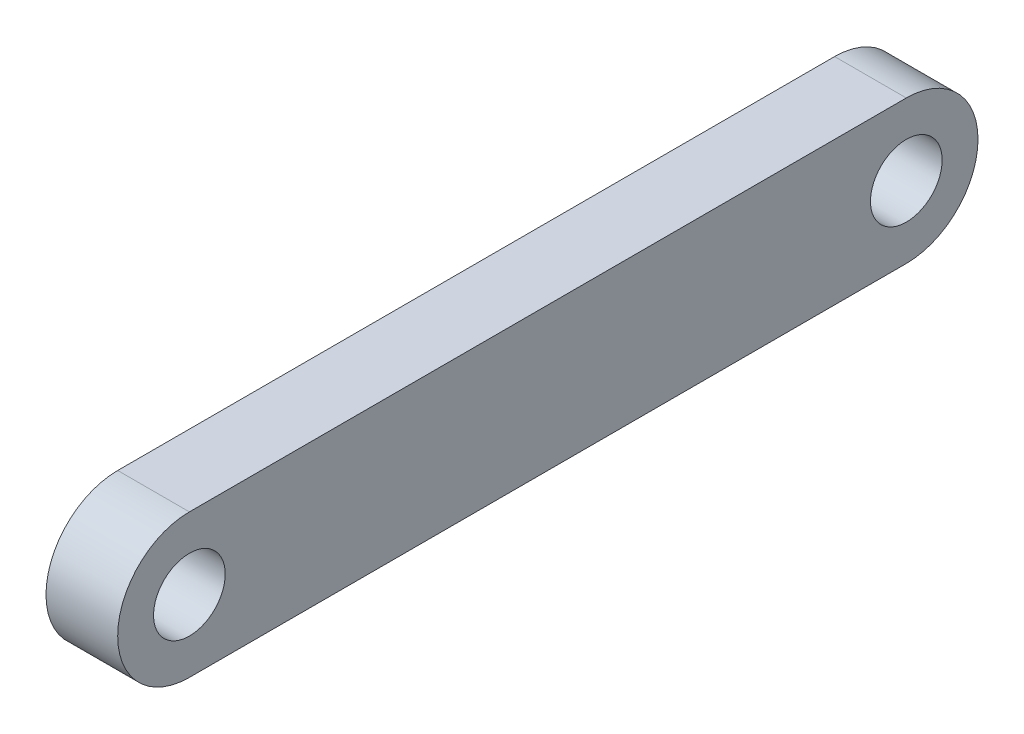
from build123d import *

# Parameters (mm, degrees)
SKETCH1_R           = 50
BOSS_EXTRUDE1_DEPTH = 100


with BuildPart() as part:
    # Sketch1 → Boss-Extrude1 (new body)
    with BuildSketch(Plane(origin=(0, 0, 0), x_dir=(0, 0, -1), z_dir=(1, 0, 0))):
        with BuildLine():
            Line((0, 100), (1000, 100))
            ThreePointArc((1000, 100), (1100, 0), (1000, -100))
            Line((1000, -100), (0, -100))
            ThreePointArc((0, -100), (-100, 0), (0, 100))
        make_face()
        Circle(SKETCH1_R, mode=Mode.SUBTRACT)
        with Locations((1000, 0)):
            Circle(SKETCH1_R, mode=Mode.SUBTRACT)
    extrude(amount=BOSS_EXTRUDE1_DEPTH)


solid = part.part
